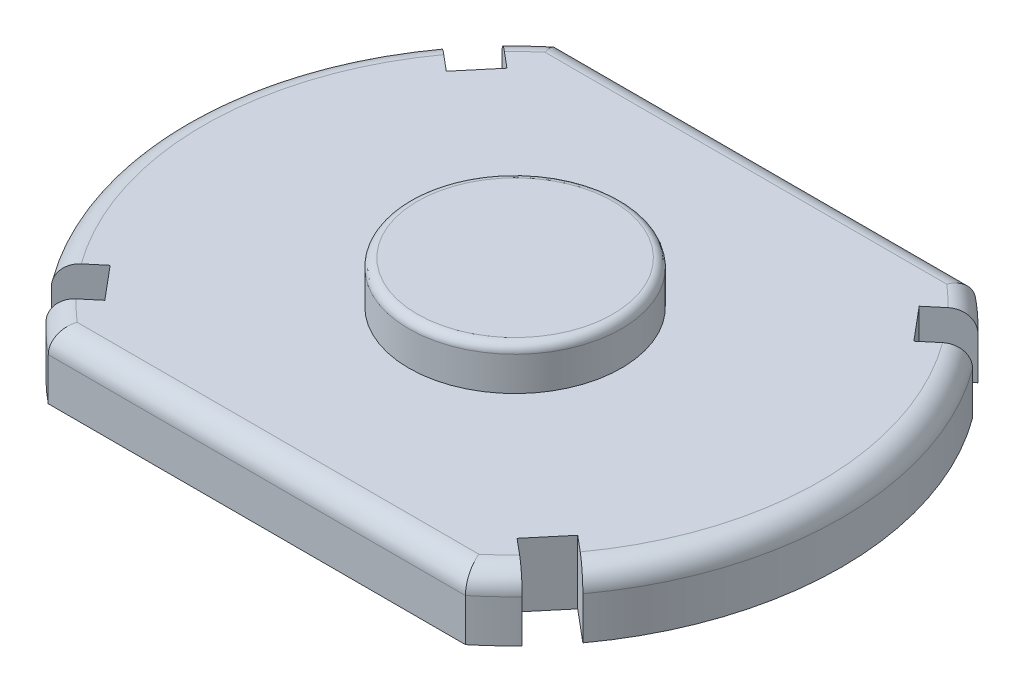
from build123d import *

# Parameters (mm, degrees)
SALIENTE_EXTRUIR1_DEPTH = 1.5
CROQUIS3_R              = 2.5
SALIENTE_EXTRUIR2_DEPTH = 1
REDONDEO2_R             = 0.5
REDONDEO3_R             = 0.2


with BuildPart() as part:
    # Croquis2 → Saliente-Extruir1 (new body)
    with BuildSketch(Plane(origin=(0, 0, 0), x_dir=(1, 0, 0), z_dir=(0, 1, 0))):
        with BuildLine():
            Line((-5.014556606, 6.035834257), (4.79615183, 6.035834257))
            ThreePointArc((4.79615183, 6.035834257), (5.152675046, 5.725750413), (5.489639121, 5.394516348))
            Line((5.489639121, 5.394516348), (4.737625192, 4.763501737))
            Line((4.737625192, 4.763501737), (5.388283977, 3.988076792))
            Line((5.388283977, 3.988076792), (6.140297907, 4.619091403))
            ThreePointArc((6.140297907, 4.619091403), (7.640797612, 0.035834257), (6.140297907, -4.547422889))
            Line((6.140297907, -4.547422889), (5.388283977, -3.916408278))
            Line((5.388283977, -3.916408278), (4.737625192, -4.691833224))
            Line((4.737625192, -4.691833224), (5.489639121, -5.322847835))
            ThreePointArc((5.489639121, -5.322847835), (5.152675046, -5.6540819), (4.79615183, -5.964165743))
            Line((4.79615183, -5.964165743), (-5.014556606, -5.964165743))
            ThreePointArc((-5.014556606, -5.964165743), (-5.371079822, -5.6540819), (-5.708043897, -5.322847835))
            Line((-5.708043897, -5.322847835), (-4.956029967, -4.691833224))
            Line((-4.956029967, -4.691833224), (-5.606688753, -3.916408278))
            Line((-5.606688753, -3.916408278), (-6.358702683, -4.547422889))
            ThreePointArc((-6.358702683, -4.547422889), (-7.859202388, 0.035834257), (-6.358702683, 4.619091403))
            Line((-6.358702683, 4.619091403), (-5.606688753, 3.988076792))
            Line((-5.606688753, 3.988076792), (-4.956029967, 4.763501737))
            Line((-4.956029967, 4.763501737), (-5.708043897, 5.394516348))
            ThreePointArc((-5.708043897, 5.394516348), (-5.371079822, 5.725750413), (-5.014556606, 6.035834257))
        make_face()
    extrude(amount=SALIENTE_EXTRUIR1_DEPTH)

    # Croquis3 → Saliente-Extruir2 (add)
    with BuildSketch(Plane(origin=(0, 1.5, 0), x_dir=(1, 0, 0), z_dir=(0, 1, 0))):
        with Locations(Location((0, 0, 0), (0, 0, 270))):
            Circle(CROQUIS3_R)
    extrude(amount=SALIENTE_EXTRUIR2_DEPTH)

    # Redondeo2
    redondeo2_edges = [part.edges().sort_by_distance(p)[0] for p in [
        (-7.859202388, 1.5, -0.035834257),
        (-5.371079822, 1.5, 5.6540819),
        (-0.109202388, 1.5, 5.964165743),
        (5.152675046, 1.5, 5.6540819),
        (-5.371079822, 1.5, -5.725750413),
        (7.640797612, 1.5, -0.035834257),
        (5.152675046, 1.5, -5.725750413),
        (-0.109202388, 1.5, -6.035834257),
    ]]
    fillet(redondeo2_edges, radius=REDONDEO2_R)

    # Redondeo3
    redondeo3_edges = [part.edges().sort_by_distance(p)[0] for p in [
        (0, 2.5, -2.5),
    ]]
    fillet(redondeo3_edges, radius=REDONDEO3_R)


solid = part.part
